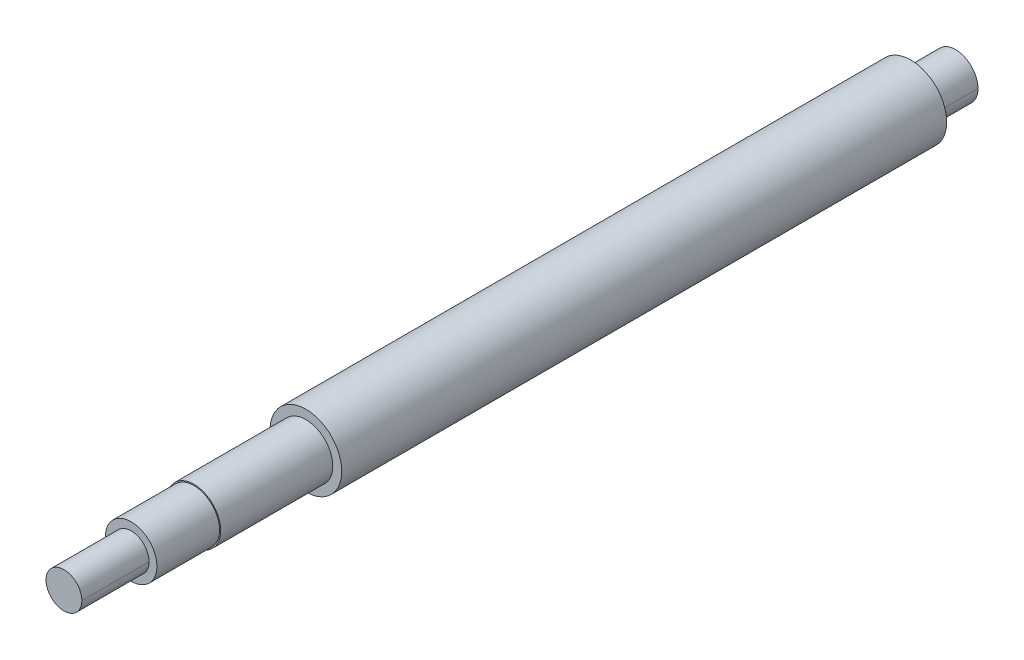
from build123d import *

# Parameters (mm, degrees)
SKETCH_1_R      = 5
EXTRUDE_1_DEPTH = 10
SKETCH_2_R      = 8
EXTRUDE_2_DEPTH = 135
SKETCH_3_R      = 6
EXTRUDE_3_DEPTH = 25
SKETCH_4_R      = 5.75
EXTRUDE_4_DEPTH = 14
SKETCH_5_R      = 4
EXTRUDE_5_DEPTH = 15


with BuildPart() as part:
    # 스케치1 → 보스-돌출1 (new body)
    with BuildSketch(Plane.XY):
        Circle(SKETCH_1_R)
    extrude(amount=EXTRUDE_1_DEPTH)

    # 스케치2 → 보스-돌출2 (add)
    with BuildSketch(Plane.XY.offset(10)):
        Circle(SKETCH_2_R)
    extrude(amount=EXTRUDE_2_DEPTH)

    # 스케치3 → 보스-돌출3 (add)
    with BuildSketch(Plane.XY.offset(145)):
        Circle(SKETCH_3_R)
    extrude(amount=EXTRUDE_3_DEPTH)

    # 스케치4 → 보스-돌출4 (add)
    with BuildSketch(Plane.XY.offset(170)):
        Circle(SKETCH_4_R)
    extrude(amount=EXTRUDE_4_DEPTH)

    # 스케치5 → 보스-돌출5 (add)
    with BuildSketch(Plane.XY.offset(184)):
        Circle(SKETCH_5_R)
    extrude(amount=EXTRUDE_5_DEPTH)


solid = part.part
